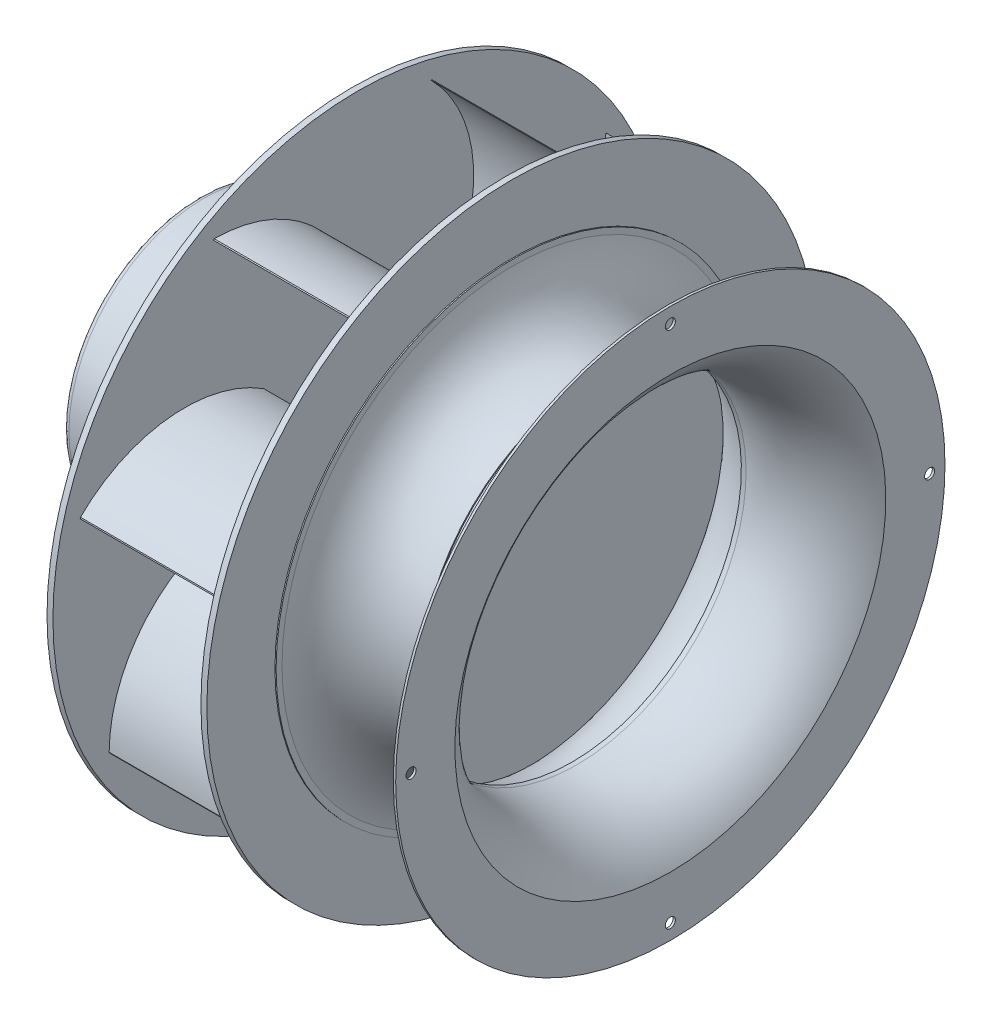
from build123d import *

# Parameters (mm, degrees)
SKETCH2_R         = 257.5
EXTRUDE1_DEPTH    = 5
SKETCH9_R         = 252.5
SKETCH9_R_2       = 100
EXTRUDE7_DEPTH    = 3
SKETCH3_R         = 257.5
EXTRUDE2_DEPTH    = 5
EXTRUDE3_DEPTH    = 130
CIRPATTERN1_COUNT = 8
SKETCH7_R         = 4.25
EXTRUDE5_DEPTH    = 5
CIRPATTERN2_COUNT = 4
SKETCH8_R         = 5
EXTRUDE6_DEPTH    = 90
CIRPATTERN3_COUNT = 8


with BuildPart() as part:
    # Sketch1 → Revolve1 (revolve)
    with BuildSketch(Plane.XY, mode=Mode.PRIVATE) as revolve1_sk:
        with BuildLine():
            Line((0, 0), (0, 109))
            ThreePointArc((0, 109), (1.464466094, 112.535533906), (5, 114))
            Line((5, 114), (70, 114))
            Line((70, 114), (70, 138))
            Line((70, 138), (90, 138))
            Line((90, 138), (90, 98))
            Line((90, 98), (95, 98))
            Line((95, 98), (95, 133))
            Line((95, 133), (105, 133))
            Line((105, 133), (105, 98))
            Line((105, 98), (130, 98))
            Line((130, 98), (130, 0))
            Line((130, 0), (0, 0))
        make_face()
    revolve(revolve1_sk.sketch.rotate(Axis((0, 0, 0), (1, 0, 0)), 90), axis=Axis((0, 0, 0), (1, 0, 0)))

    # Sketch2 → Extrude1 (add)
    with BuildSketch(Plane(origin=(130, 0, 0), x_dir=(0, 0, -1), z_dir=(1, 0, 0))):
        Circle(SKETCH2_R)
    extrude(amount=EXTRUDE1_DEPTH)

    # Sketch9 → Extrude7 (cut)
    with BuildSketch(Plane.ZY.offset(-130)):
        Circle(SKETCH9_R)
        Circle(SKETCH9_R_2, mode=Mode.SUBTRACT)
    extrude(amount=-EXTRUDE7_DEPTH, mode=Mode.SUBTRACT)



with BuildPart() as body_2:
    # Sketch3 → Extrude2 (new body)
    with BuildSketch(Plane(origin=(260, 0, 0), x_dir=(0, 0, -1), z_dir=(1, 0, 0))):
        Circle(SKETCH3_R)
    extrude(amount=EXTRUDE2_DEPTH)


with BuildPart() as part_1:
    add(part.part)

    add(body_2.part)  # Extrude3 merges body 2
    # Sketch4 → Extrude3 (add)
    with BuildSketch(Plane(origin=(135, 0, 0), x_dir=(0, 0, -1), z_dir=(1, 0, 0))):
        with BuildLine():
            Line((-121.25, 210.011160418), (-122.116025404, 209.511160418))
            ThreePointArc((-122.116025404, 209.511160418), (-44.469436379, 181.921031018), (-0.866025404, 112))
            Line((-0.866025404, 112), (0, 112.5))
            ThreePointArc((0, 112.5), (-43.603410976, 182.421031018), (-121.25, 210.011160418))
        make_face()
    extrude3 = extrude(amount=EXTRUDE3_DEPTH)

    # CirPattern1: Extrude3 ×8 about axis
    cirpattern1_axis = Axis((0, 0, 0), (1, 0, 0))
    for i in range(1, CIRPATTERN1_COUNT):
        add(extrude3.rotate(cirpattern1_axis, i * 360 / CIRPATTERN1_COUNT))

    # Sketch5 → Revolve2 (revolve)
    with BuildSketch(Plane.XY, mode=Mode.PRIVATE) as revolve2_sk:
        with BuildLine():
            Line((265, 200), (266, 200))
            Line((266, 200), (266, 195))
            ThreePointArc((266, 195), (290.025762909, 156.658201589), (334, 146))
            Line((334, 146), (334, 145))
            ThreePointArc((334, 145), (289.082569219, 155.623945523), (265, 195))
            Line((265, 195), (265, 200))
        make_face()
    revolve(revolve2_sk.sketch.rotate(Axis((0, 0, 0), (1, 0, 0)), 90), axis=Axis((0, 0, 0), (1, 0, 0)))

    # Sketch8 → Extrude6 (cut)
    with BuildSketch(Plane(origin=(0, 0, 0), x_dir=(0, 0, -1), z_dir=(1, 0, 0))):
        with Locations(Location((0, 126, 0), (0, 0, 180))):
            Circle(SKETCH8_R)
    extrude6 = extrude(amount=EXTRUDE6_DEPTH, mode=Mode.SUBTRACT)

    # CirPattern3: Extrude6 ×8 about axis
    cirpattern3_axis = Axis((0, 0, 0), (1, 0, 0))
    for i in range(1, CIRPATTERN3_COUNT):
        add(extrude6.rotate(cirpattern3_axis, i * 360 / CIRPATTERN3_COUNT), mode=Mode.SUBTRACT)


with BuildPart() as body_2_2:
    # Sketch6 → Revolve3 (revolve)
    with BuildSketch(Plane.XY, mode=Mode.PRIVATE) as revolve3_sk:
        with BuildLine():
            Line((399, 232), (397, 232))
            Line((397, 232), (397, 182))
            ThreePointArc((397, 182), (363.85220133, 152.361635071), (320, 145))
            Line((320, 145), (316, 145))
            Line((316, 145), (316, 143))
            Line((316, 143), (320, 143))
            ThreePointArc((320, 143), (365.352293074, 150.645355054), (399, 182))
            Line((399, 182), (399, 232))
        make_face()
    revolve(revolve3_sk.sketch.rotate(Axis((0, 0, 0), (1, 0, 0)), 180), axis=Axis((0, 0, 0), (1, 0, 0)))

    # Sketch7 → Extrude5 (cut)
    with BuildSketch(Plane(origin=(399, 0, 0), x_dir=(0, 0, -1), z_dir=(1, 0, 0))):
        with Locations((0, 219)):
            Circle(SKETCH7_R)
    extrude5 = extrude(amount=-EXTRUDE5_DEPTH, mode=Mode.SUBTRACT)

    # CirPattern2: Extrude5 ×4 about axis
    cirpattern2_axis = Axis((0, 0, 0), (1, 0, 0))
    for i in range(1, CIRPATTERN2_COUNT):
        add(extrude5.rotate(cirpattern2_axis, i * 360 / CIRPATTERN2_COUNT), mode=Mode.SUBTRACT)


solid = Compound([part_1.part, body_2_2.part])
